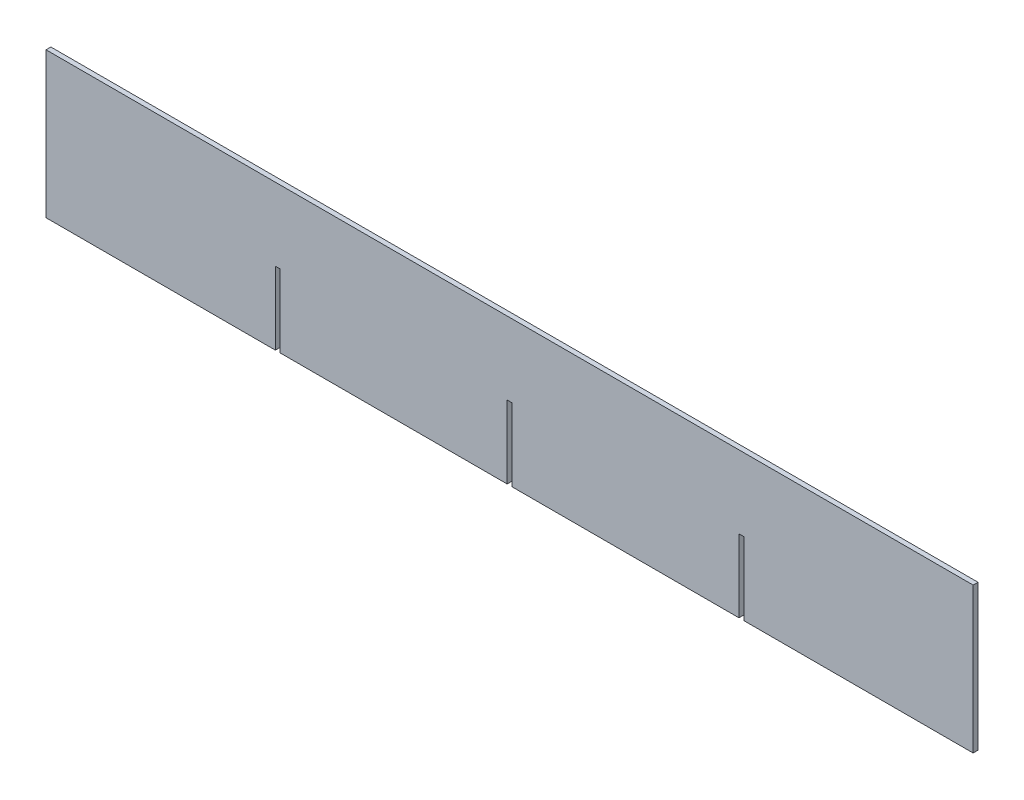
from build123d import *

# Parameters (mm, degrees)
BOSS_EXTRUDE1_DEPTH = 1.25


with BuildPart() as part:
    # Sketch1 → Boss-Extrude1 (new, symmetric)
    with BuildSketch(Plane.XY):
        Polygon((-1.25, -37.5), (-1.25, 0), (1.25, 0), (1.25, -37.5), (118.25, -37.5), (118.25, 0), (120.75, 0), (120.75, -37.5), (239, -37.5), (239, 37.5), (-239, 37.5), (-239, -37.5), (-120.75, -37.5), (-120.75, 0), (-118.25, 0), (-118.25, -37.5), align=None)
    extrude(amount=BOSS_EXTRUDE1_DEPTH, both=True)


solid = part.part
